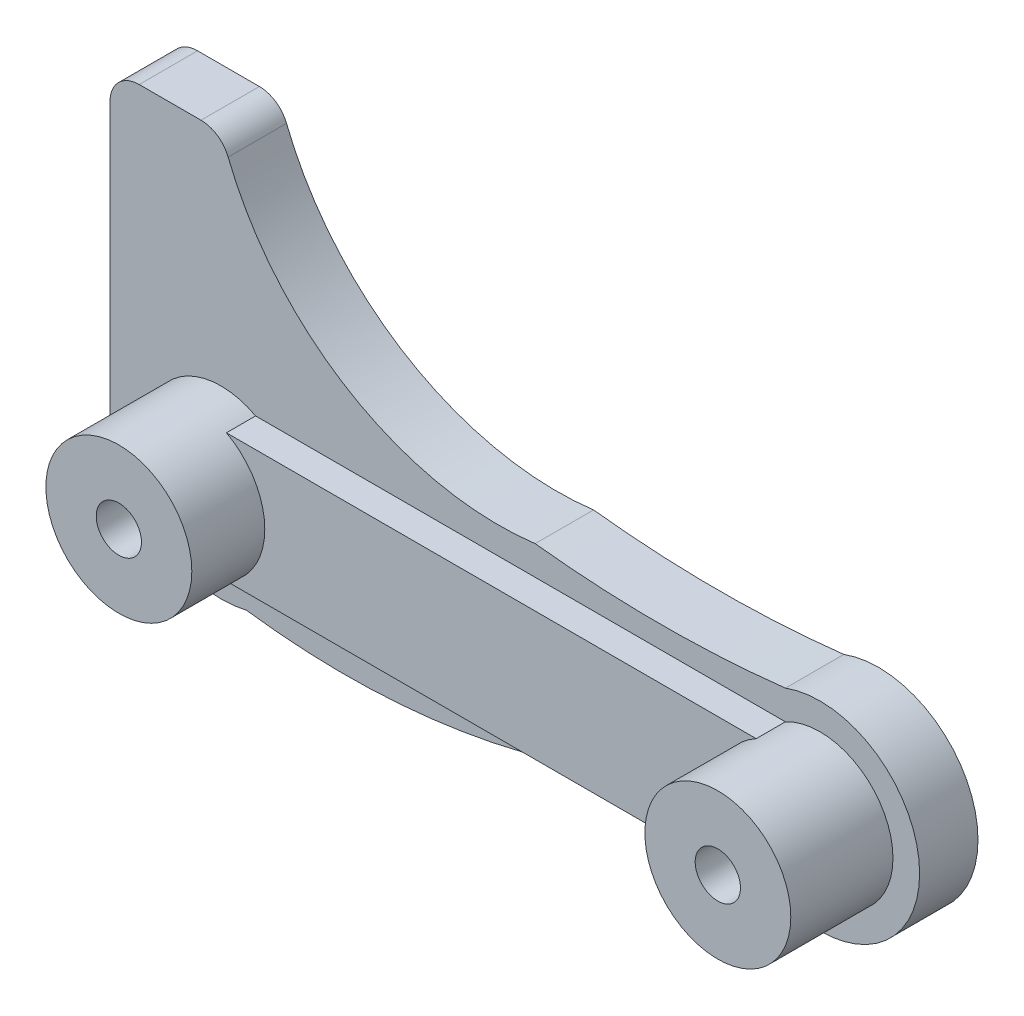
from build123d import *

# Parameters (mm, degrees)
BOSS_EXTRU_1_DEPTH      = 3
BOSS_EXTRU_1_DEPTH_BACK = 3
ESQUISSE2_R             = 1.55
ENL_V_MAT_EXTRU_1_DEPTH = 6
SKETCH1_R               = 5
SKETCH1_R_2             = 1.55
BOSS_EXTRUDE1_DEPTH     = 5
BOSS_EXTRUDE3_DEPTH     = 4
FILLET1_R               = 2


with BuildPart() as part:
    # Esquisse1 → Boss.-Extru.1 (new, two sides: drawn at the far end of the back side and taken through both)
    with BuildSketch(Plane.XY.offset(-BOSS_EXTRU_1_DEPTH_BACK)):
        with BuildLine():
            Line((2.370532565, 4.402337488), (38.670532565, 4.402337488))
            ThreePointArc((38.670532565, 4.402337488), (46.041065131, 0), (38.670532565, -4.402337488))
            Line((38.670532565, -4.402337488), (2.370532565, -4.402337488))
            ThreePointArc((2.370532565, -4.402337488), (-5, 0), (2.370532565, 4.402337488))
        make_face()
    extrude(amount=BOSS_EXTRU_1_DEPTH + BOSS_EXTRU_1_DEPTH_BACK)

    # Esquisse2 → Enlèv. mat.-Extru.1 (cut)
    with BuildSketch(Plane.XY.offset(3)):
        Circle(ESQUISSE2_R)
        with Locations((41.041065131, 0)):
            Circle(ESQUISSE2_R)
    extrude(amount=-ENL_V_MAT_EXTRU_1_DEPTH, mode=Mode.SUBTRACT)

    # Sketch1 → Boss-Extrude1 (add)
    # profile 1 of 2: a face of its own
    with BuildSketch(Plane.XY.offset(3)):
        Circle(SKETCH1_R)
        Circle(SKETCH1_R_2, mode=Mode.SUBTRACT)
    # profile 2 of 2: a face of its own
    with BuildSketch(Plane.XY.offset(3)):
        with Locations((41.041065131, 0)):
            Circle(SKETCH1_R)
        with Locations((41.041065131, 0)):
            Circle(SKETCH1_R_2, mode=Mode.SUBTRACT)
    extrude(amount=BOSS_EXTRUDE1_DEPTH)

    # Sketch3 → Boss-Extrude3 (add)
    with BuildSketch(Plane(origin=(0, 0, -3), x_dir=(-1, 0, 0), z_dir=(0, 0, -1))):
        with BuildLine():
            Line((-0.036278369, 20.080410503), (7.604339365, 20.080410503))
            Line((7.604339365, 20.080410503), (7.604339365, -0.784525769))
            ThreePointArc((7.604339365, -0.784525769), (4.435345697, -6.226489092), (-1.743406195, -7.443251487))
            ThreePointArc((-1.743406195, -7.443251487), (-11.242367754, -7.816197838), (-20.642918726, -6.402337488))
            ThreePointArc((-20.642918726, -6.402337488), (-29.656725646, -5.741977649), (-38.670532565, -6.402337488))
            ThreePointArc((-38.670532565, -6.402337488), (-47.868169198, 0), (-38.670532565, 6.402337488))
            ThreePointArc((-38.670532565, 6.402337488), (-30.098734584, 5.912843699), (-21.526936603, 6.402337488))
            ThreePointArc((-21.526936603, 6.402337488), (-8.31538788, 9.366509266), (-0.036278369, 20.080410503))
        make_face()
        with BuildLine():
            Line((-38.670532565, 4.402337488), (-2.370532565, 4.402337488))
            ThreePointArc((-2.370532565, 4.402337488), (5, 0), (-2.370532565, -4.402337488))
            Line((-2.370532565, -4.402337488), (-38.670532565, -4.402337488))
            ThreePointArc((-38.670532565, -4.402337488), (-46.041065131, 0), (-38.670532565, 4.402337488))
        make_face(mode=Mode.SUBTRACT)
    extrude(amount=-BOSS_EXTRUDE3_DEPTH)

    # Fillet1
    fillet1_edges = [part.edges().sort_by_distance(p)[0] for p in [
        (0.036278369, 20.080410503, -1),
        (-7.604339365, 20.080410503, -1),
    ]]
    fillet(fillet1_edges, radius=FILLET1_R)


solid = part.part
